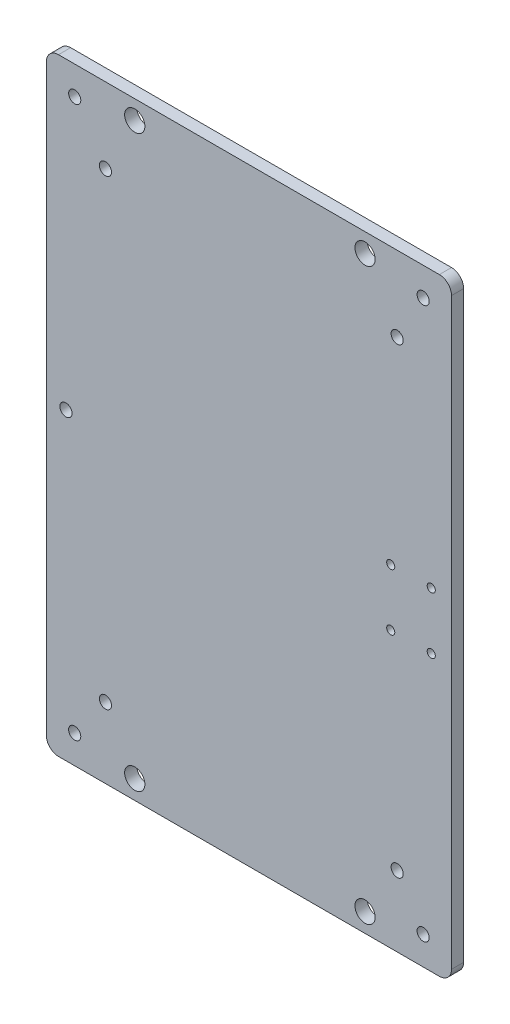
from build123d import *

# Parameters (mm, degrees)
SKETCH_1_R          = 1.5
SKETCH_1_R_2        = 1
EXTRUDE_1_DEPTH     = 3
SKETCH_2_R          = 1.5
CUT_EXTRUDE_2_DEPTH = 10
SKETCH_2_6_R        = 2.5
CUT_EXTRUDE_3_DEPTH = 10
SKETCH_2_7_R        = 2.5
CUT_EXTRUDE_4_DEPTH = 10


with BuildPart() as part:
    # 草图1 → 凸台-拉伸1 (new body)
    with BuildSketch(Plane.XY):
        with BuildLine():
            Line((-102, -62), (-8, -62))
            ThreePointArc((-8, -62), (-5.878679656, -61.121320344), (-5, -59))
            Line((-5, -59), (-5, 85))
            ThreePointArc((-5, 85), (-5.878679656, 87.121320344), (-8, 88))
            Line((-8, 88), (-102, 88))
            ThreePointArc((-102, 88), (-104.121320344, 87.121320344), (-105, 85))
            Line((-105, 85), (-105, -59))
            ThreePointArc((-105, -59), (-104.121320344, -61.121320344), (-102, -62))
        make_face()
        with Locations((-100.157022476, 13)):
            Circle(SKETCH_1_R, mode=Mode.SUBTRACT)
        with Locations((-12, 81)):
            Circle(SKETCH_1_R, mode=Mode.SUBTRACT)
        with Locations((-98, -55)):
            Circle(SKETCH_1_R, mode=Mode.SUBTRACT)
        with Locations((-98, 81)):
            Circle(SKETCH_1_R, mode=Mode.SUBTRACT)
        with Locations((-12, -55)):
            Circle(SKETCH_1_R, mode=Mode.SUBTRACT)
        with Locations((-10, 6)):
            Circle(SKETCH_1_R_2, mode=Mode.SUBTRACT)
        with Locations((-20, 20)):
            Circle(SKETCH_1_R_2, mode=Mode.SUBTRACT)
        with Locations((-20, 6)):
            Circle(SKETCH_1_R_2, mode=Mode.SUBTRACT)
        with Locations((-10, 20)):
            Circle(SKETCH_1_R_2, mode=Mode.SUBTRACT)
    extrude(amount=-EXTRUDE_1_DEPTH)

    # 草图2 → 切除-拉伸2 (cut)
    with BuildSketch(Plane.XY):
        with Locations((-90.41, 69.42)):
            Circle(SKETCH_2_R)
        with Locations((-18.41, 69.42)):
            Circle(SKETCH_2_R)
        with Locations((-90.41, -44.58)):
            Circle(SKETCH_2_R)
        with Locations((-18.41, -44.58)):
            Circle(SKETCH_2_R)
    extrude(amount=-CUT_EXTRUDE_2_DEPTH, mode=Mode.SUBTRACT)

    # 草图2<6> → 切除-拉伸3 (cut)
    with BuildSketch(Plane.XY):
        with Locations((-83.178616271, -57.326639146)):
            Circle(SKETCH_2_6_R)
        with Locations((-26.33472009, -57.326639146)):
            Circle(SKETCH_2_6_R)
    extrude(amount=-CUT_EXTRUDE_3_DEPTH, mode=Mode.SUBTRACT)

    # 草图2<7> → 切除-拉伸4 (cut)
    with BuildSketch(Plane.XY):
        with Locations((-83.178616271, 83.33)):
            Circle(SKETCH_2_7_R)
        with Locations((-26.33472009, 83.33)):
            Circle(SKETCH_2_7_R)
    extrude(amount=-CUT_EXTRUDE_4_DEPTH, mode=Mode.SUBTRACT)


solid = part.part
